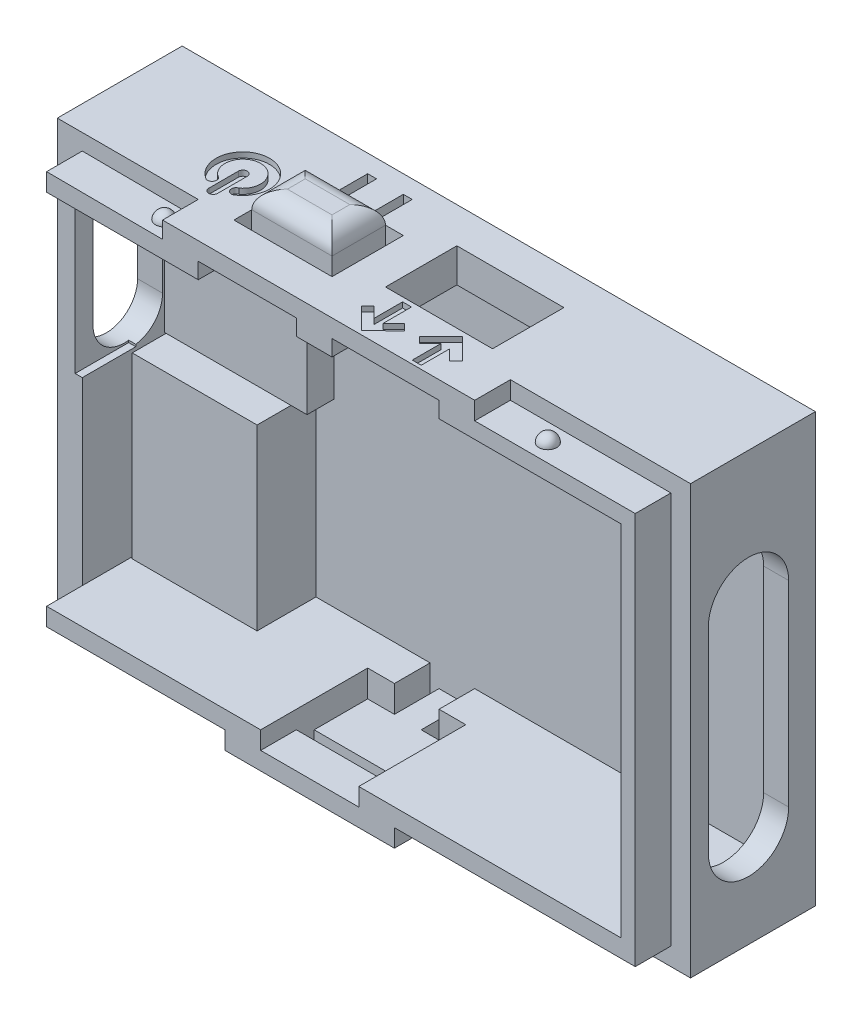
from build123d import *

# Parameters (mm, degrees)
SKETCH_1_W           = 35.5
SKETCH_1_H           = 24
EXTRUDE_1_DEPTH      = 7
SKETCH_2_W           = 33.2
SKETCH_2_H           = 22.1
CUT_EXTRUDE_1_DEPTH  = 6
CUT_EXTRUDE_2_DEPTH  = 2
EXTRUDE_2_DEPTH      = 6
SKETCH_7_W           = 5
SKETCH_7_H           = 2
EXTRUDE_3_DEPTH      = 5
CUT_EXTRUDE_4_DEPTH  = 2
SKETCH_12_W          = 5.5
SKETCH_12_H          = 2
CUT_EXTRUDE_6_DEPTH  = 6
SKETCH_19_W          = 8
SKETCH_19_H          = 10
USB_DEPTH            = 1.5
SKETCH_25_W          = 0.5
SKETCH_25_H          = 18.1
CUT_EXTRUDE_12_DEPTH = 6
SKETCH_28_W          = 5.5
SKETCH_28_H          = 1.9
CUT_EXTRUDE_13_DEPTH = 6
SKETCH_29_W          = 6
SKETCH_29_H          = 2
CUT_EXTRUDE_14_DEPTH = 5
SKETCH_34_W          = 7
SKETCH_34_H          = 10
EXTRUDE_10_DEPTH     = 3.3
SKETCH_35_W          = 0.5
SKETCH_35_H          = 10
CUT_EXTRUDE_15_DEPTH = 3
SKETCH_37_W          = 4.5
SKETCH_37_H          = 2
EXTRUDE_12_DEPTH     = 5.5
SKETCH_38_W          = 1.5
SKETCH_38_H          = 2.5
CUT_EXTRUDE_16_DEPTH = 2
SKETCH_39_W          = 4.5
SKETCH_39_H          = 1
CUT_EXTRUDE_17_DEPTH = 5.5
SKETCH_40_W          = 4.5
SKETCH_40_H          = 3
EXTRUDE_13_DEPTH     = 1.5
FILLET_2_R           = 1
SKETCH_41_W          = 4.5
SKETCH_41_H          = 2
EXTRUDE_14_DEPTH     = 5.5
SKETCH_42_W          = 1.5
SKETCH_42_H          = 2.5
CUT_EXTRUDE_18_DEPTH = 2
SKETCH_43_W          = 4.5
SKETCH_43_H          = 1
CUT_EXTRUDE_19_DEPTH = 5.5
SKETCH_44_W          = 4.5
SKETCH_44_H          = 3
EXTRUDE_15_DEPTH     = 1.5
FILLET_3_R           = 1
EXTRUDE_16_DEPTH     = 2
SKETCH_50_W          = 5.5
SKETCH_50_H          = 2
CUT_EXTRUDE_20_DEPTH = 2
SKETCH_51_W          = 5.5
SKETCH_51_H          = 2
CUT_EXTRUDE_21_DEPTH = 2
SKETCH_54_W          = 2
SKETCH_54_H          = 0.95
EXTRUDE_19_DEPTH     = 2
SKETCH_55_W          = 2
SKETCH_55_H          = 1
EXTRUDE_20_DEPTH     = 15.5
SKETCH_56_W          = 2
SKETCH_56_H          = 1
EXTRUDE_21_DEPTH     = 2
SKETCH_57_W          = 2
SKETCH_57_H          = 1
EXTRUDE_22_DEPTH     = 7.5
SKETCH_58_W          = 1.5
SKETCH_58_H          = 1.9
SKETCH_58_H_2        = 2
EXTRUDE_24_DEPTH     = 2
SKETCH_59_W          = 6
SKETCH_59_H          = 1
EXTRUDE_25_DEPTH     = 1
CUT_EXTRUDE_22_DEPTH = 0.3
CUT_EXTRUDE_23_DEPTH = 0.3


with BuildPart() as part:
    # 草图1 → 凸台-拉伸1 (new body)
    with BuildSketch(Plane.XY):
        Rectangle(SKETCH_1_W, SKETCH_1_H)
    extrude(amount=EXTRUDE_1_DEPTH)

    # 草图2 → 切除-拉伸1 (cut)
    with BuildSketch(Plane.XY.offset(7)):
        with Locations((0.25, 0.05)):
            Rectangle(SKETCH_2_W, SKETCH_2_H)
    extrude(amount=-CUT_EXTRUDE_1_DEPTH, mode=Mode.SUBTRACT)

    # 草图3 → 切除-拉伸2 (cut)
    with BuildSketch(Plane.ZY.offset(17.75)):
        with BuildLine():
            Line((6, 7.45), (6, 1.95))
            ThreePointArc((6, 1.95), (4.25, 0.2), (2.5, 1.95))
            Line((2.5, 1.95), (2.5, 7.45))
            ThreePointArc((2.5, 7.45), (4.25, 9.2), (6, 7.45))
        make_face()
    extrude(amount=-CUT_EXTRUDE_2_DEPTH, mode=Mode.SUBTRACT)

    # 草图6 → 凸台-拉伸2 (add)
    with BuildSketch(Plane.XY.offset(1)):
        Polygon((-16.35, 10.1), (15.85, 10.1), (15.85, -10), (-16.35, -10), (-16.35, -11), (16.85, -11), (16.85, 11.1), (-16.35, 11.1), align=None)
    extrude(amount=EXTRUDE_2_DEPTH)

    # 草图7 → 凸台-拉伸3 (add)
    with BuildSketch(Plane.XY.offset(1)):
        with Locations((13.35, 9.1)):
            Rectangle(SKETCH_7_W, SKETCH_7_H)
    extrude(amount=EXTRUDE_3_DEPTH)

    # 草图10 → 切除-拉伸4 (cut)
    with BuildSketch(Plane.ZY.offset(-15.85)):
        with BuildLine():
            Line((1.5, -6.45), (1.5, 4.55))
            ThreePointArc((1.5, 4.55), (3.75, 6.8), (6, 4.55))
            Line((6, 4.55), (6, -6.45))
            ThreePointArc((6, -6.45), (3.75, -8.7), (1.5, -6.45))
        make_face()
    extrude(amount=-CUT_EXTRUDE_4_DEPTH, mode=Mode.SUBTRACT)

    # 草图12 → 切除-拉伸6 (cut)
    with BuildSketch(Plane.XY.offset(7)):
        with Locations((-1.6, -11)):
            Rectangle(SKETCH_12_W, SKETCH_12_H)
    extrude(amount=-CUT_EXTRUDE_6_DEPTH, mode=Mode.SUBTRACT)

    # 草图19 → USB支撑 (add)
    with BuildSketch(Plane.XY.offset(1)):
        with Locations((-12.25, 5.1)):
            Rectangle(SKETCH_19_W, SKETCH_19_H)
    extrude(amount=USB_DEPTH)

    # 草图25 → 切除-拉伸12 (cut)
    with BuildSketch(Plane.XY.offset(7)):
        with Locations((16.1, -0.95)):
            Rectangle(SKETCH_25_W, SKETCH_25_H)
    extrude(amount=-CUT_EXTRUDE_12_DEPTH, mode=Mode.SUBTRACT)

    # 草图28 → 切除-拉伸13 (cut)
    with BuildSketch(Plane.XY.offset(7)):
        with Locations((-5.1, 11.05)):
            Rectangle(SKETCH_28_W, SKETCH_28_H)
    extrude(amount=-CUT_EXTRUDE_13_DEPTH, mode=Mode.SUBTRACT)

    # 草图29 → 切除-拉伸14 (cut)
    with BuildSketch(Plane.XY.offset(7)):
        with Locations((2.65, 11)):
            Rectangle(SKETCH_29_W, SKETCH_29_H)
    extrude(amount=-CUT_EXTRUDE_14_DEPTH, mode=Mode.SUBTRACT)

    # 草图34 → 凸台-拉伸10 (add)
    with BuildSketch(Plane.XY.offset(1)):
        with Locations((-12.75, -5)):
            Rectangle(SKETCH_34_W, SKETCH_34_H)
    extrude(amount=EXTRUDE_10_DEPTH)

    # 草图35 → 切除-拉伸15 (cut)
    with BuildSketch(Plane.XY.offset(7)):
        with Locations((-16.5, 5.1)):
            Rectangle(SKETCH_35_W, SKETCH_35_H)
    extrude(amount=-CUT_EXTRUDE_15_DEPTH, mode=Mode.SUBTRACT)

    # 草图37 → 凸台-拉伸12 (add)
    with BuildSketch(Plane.XY.offset(1)):
        with Locations((-1.6, -11)):
            Rectangle(SKETCH_37_W, SKETCH_37_H)
    extrude(amount=EXTRUDE_12_DEPTH)

    # 草图38 → 切除-拉伸16 (cut)
    with BuildSketch(Plane.XZ.offset(12)):
        with Locations((-3.1, 2.25)):
            Rectangle(SKETCH_38_W, SKETCH_38_H)
        with Locations((-0.1, 2.25)):
            Rectangle(SKETCH_38_W, SKETCH_38_H)
    extrude(amount=-CUT_EXTRUDE_16_DEPTH, mode=Mode.SUBTRACT)

    # 草图39 → 切除-拉伸17 (cut)
    with BuildSketch(Plane.XY.offset(6.5)):
        with Locations((-1.6, -10.5)):
            Rectangle(SKETCH_39_W, SKETCH_39_H)
    extrude(amount=-CUT_EXTRUDE_17_DEPTH, mode=Mode.SUBTRACT)

    # 草图40 → 凸台-拉伸13 (add)
    with BuildSketch(Plane.XZ.offset(12)):
        with Locations((-1.6, 5)):
            Rectangle(SKETCH_40_W, SKETCH_40_H)
    extrude(amount=EXTRUDE_13_DEPTH)

    # 圆角2
    fillet_2_edges = [part.edges().sort_by_distance(p)[0] for p in [
        (-1.6, -13.5, 3.5),
        (0.65, -13.5, 5),
        (-1.6, -13.5, 6.5),
        (-3.85, -13.5, 5),
    ]]
    fillet(fillet_2_edges, radius=FILLET_2_R)

    # 草图41 → 凸台-拉伸14 (add)
    with BuildSketch(Plane.XY.offset(1)):
        with Locations((-5.1, 11)):
            Rectangle(SKETCH_41_W, SKETCH_41_H)
    extrude(amount=EXTRUDE_14_DEPTH)

    # 草图42 → 切除-拉伸18 (cut)
    with BuildSketch(Plane(origin=(0, 12, 0), x_dir=(1, 0, 0), z_dir=(0, 1, 0))):
        with Locations((-6.6, -2.25)):
            Rectangle(SKETCH_42_W, SKETCH_42_H)
        with Locations((-3.6, -2.25)):
            Rectangle(SKETCH_42_W, SKETCH_42_H)
    extrude(amount=-CUT_EXTRUDE_18_DEPTH, mode=Mode.SUBTRACT)

    # 草图43 → 切除-拉伸19 (cut)
    with BuildSketch(Plane.XY.offset(6.5)):
        with Locations((-5.1, 10.5)):
            Rectangle(SKETCH_43_W, SKETCH_43_H)
    extrude(amount=-CUT_EXTRUDE_19_DEPTH, mode=Mode.SUBTRACT)

    # 草图44 → 凸台-拉伸15 (add)
    with BuildSketch(Plane(origin=(0, 12, 0), x_dir=(1, 0, 0), z_dir=(0, 1, 0))):
        with Locations((-5.1, -5)):
            Rectangle(SKETCH_44_W, SKETCH_44_H)
    extrude(amount=EXTRUDE_15_DEPTH)

    # 圆角3
    fillet_3_edges = [part.edges().sort_by_distance(p)[0] for p in [
        (-2.85, 13.5, 5),
        (-5.1, 13.5, 3.5),
        (-7.35, 13.5, 5),
        (-5.1, 13.5, 6.5),
    ]]
    fillet(fillet_3_edges, radius=FILLET_3_R)

    # 草图45 → 凸台-拉伸16 (add)
    with BuildSketch(Plane.XY.offset(7)):
        Polygon((-7.85, 10.1), (-16.35, 10.1), (-16.35, 11.1), (-7.85, 11.05), (-2.25, 11.05), (-0.35, 11.05), (-0.35, 10.1), (-2.35, 10.1), align=None)
        Polygon((1.25, -11), (-16.35, -11), (-16.35, -10), (1.15, -10), (15.85, -10), (15.85, 10.1), (5.65, 10.1), (5.65, 11), (16.65, 11), (16.65, 10), (16.65, -11), align=None)
    extrude(amount=EXTRUDE_16_DEPTH)

    # 草图46 → 旋转1 (revolve)
    with BuildSketch(Plane.XZ.offset(11)):
        with BuildLine():
            Line((-11.25, 8), (-10.25, 8))
            ThreePointArc((-10.25, 8), (-10.75, 8.5), (-11.25, 8))
        make_face()
    revolve(axis=Axis((-11.25, -11, 8), (1, 0, 0)))

    # 草图47 → 旋转2 (revolve)
    with BuildSketch(Plane.XZ.offset(11)):
        with BuildLine():
            Line((11.25, 8), (10.25, 8))
            ThreePointArc((10.25, 8), (10.75, 8.5), (11.25, 8))
        make_face()
    revolve(axis=Axis((11.25, -11, 8), (-1, 0, 0)))

    # 草图48 → 旋转3 (revolve)
    with BuildSketch(Plane(origin=(0, 11.05, 0), x_dir=(1, 0, 0), z_dir=(0, 1, 0))):
        with BuildLine():
            Line((-11.25, -8), (-10.25, -8))
            ThreePointArc((-10.25, -8), (-10.75, -7.5), (-11.25, -8))
        make_face()
    revolve(axis=Axis((-11.25, 11.05, 8), (1, 0, 0)))

    # 草图49 → 旋转4 (revolve)
    with BuildSketch(Plane(origin=(0, 11, 0), x_dir=(1, 0, 0), z_dir=(0, 1, 0))):
        with BuildLine():
            Line((10.25, -8), (11.25, -8))
            ThreePointArc((11.25, -8), (10.75, -7.5), (10.25, -8))
        make_face()
    revolve(axis=Axis((10.25, 11, 8), (1, 0, 0)))

    # 草图50 → 切除-拉伸20 (cut)
    with BuildSketch(Plane.XZ.offset(-10.1)):
        with Locations((-5.1, 8)):
            Rectangle(SKETCH_50_W, SKETCH_50_H)
    extrude(amount=-CUT_EXTRUDE_20_DEPTH, mode=Mode.SUBTRACT)

    # 草图51 → 切除-拉伸21 (cut)
    with BuildSketch(Plane.XZ.offset(11)):
        with Locations((-1.6, 8)):
            Rectangle(SKETCH_51_W, SKETCH_51_H)
    extrude(amount=-CUT_EXTRUDE_21_DEPTH, mode=Mode.SUBTRACT)

    # 草图54 → 凸台-拉伸19 (add)
    with BuildSketch(Plane.XY.offset(7)):
        with Locations((-8.85, 11.525)):
            Rectangle(SKETCH_54_W, SKETCH_54_H)
    extrude(amount=EXTRUDE_19_DEPTH)

    # 草图55 → 凸台-拉伸20 (add)
    with BuildSketch(Plane(origin=(-7.85, 0, 0), x_dir=(0, 0, -1), z_dir=(1, 0, 0))):
        with Locations((-8, 11.5)):
            Rectangle(SKETCH_55_W, SKETCH_55_H)
    extrude(amount=EXTRUDE_20_DEPTH)

    # 草图56 → 凸台-拉伸21 (add)
    with BuildSketch(Plane.XY.offset(7)):
        with Locations((-5.35, -11.5)):
            Rectangle(SKETCH_56_W, SKETCH_56_H)
    extrude(amount=EXTRUDE_21_DEPTH)

    # 草图57 → 凸台-拉伸22 (add)
    with BuildSketch(Plane(origin=(-4.35, 0, 0), x_dir=(0, 0, -1), z_dir=(1, 0, 0))):
        with Locations((-8, -11.5)):
            Rectangle(SKETCH_57_W, SKETCH_57_H)
    extrude(amount=EXTRUDE_22_DEPTH)

    # 草图58 → 凸台-拉伸24 (add)
    with BuildSketch(Plane.XY.offset(1)):
        with Locations((-7.1, 11.05)):
            Rectangle(SKETCH_58_W, SKETCH_58_H)
        with Locations((-3.1, 11.05)):
            Rectangle(SKETCH_58_W, SKETCH_58_H)
        with Locations((-3.6, -11)):
            Rectangle(SKETCH_58_W, SKETCH_58_H_2)
        with Locations((0.4, -11)):
            Rectangle(SKETCH_58_W, SKETCH_58_H_2)
    extrude(amount=EXTRUDE_24_DEPTH)

    # 草图59 → 凸台-拉伸25 (add)
    with BuildSketch(Plane(origin=(0, 0, 7), x_dir=(-1, 0, 0), z_dir=(0, 0, -1))):
        with Locations((-2.65, 11.5)):
            Rectangle(SKETCH_59_W, SKETCH_59_H)
    extrude(amount=EXTRUDE_25_DEPTH)

    # 草图61 → 切除-拉伸22 (cut)
    with BuildSketch(Plane(origin=(0, 12, 0), x_dir=(1, 0, 0), z_dir=(0, 1, 0))):
        with BuildLine():
            Line((-9.6, -6.159611152), (-9.6, -4.5))
            ThreePointArc((-9.6, -4.5), (-9.85, -4.25), (-10.1, -4.5))
            Line((-10.1, -4.5), (-10.1, -6.159611152))
            ThreePointArc((-10.1, -6.159611152), (-9.85, -6.409611152), (-9.6, -6.159611152))
        make_face()
        with BuildLine():
            ThreePointArc((-9.101668523, -5.8), (-9.85, -3), (-10.598331477, -5.8))
            ThreePointArc((-10.598331477, -5.8), (-10.274165739, -5.624165739), (-10.45, -5.3))
            ThreePointArc((-10.45, -5.3), (-9.85, -3.5), (-9.25, -5.3))
            ThreePointArc((-9.25, -5.3), (-9.425834261, -5.624165739), (-9.101668523, -5.8))
        make_face()
    extrude(amount=-CUT_EXTRUDE_22_DEPTH, mode=Mode.SUBTRACT)

    # 草图60 → 切除-拉伸23 (cut)
    with BuildSketch(Plane(origin=(0, 12, 0), x_dir=(1, 0, 0), z_dir=(0, 1, 0))):
        Polygon((4.45, -8.8), (4.45, -7.2), (5.049338639, -7.8), (5.403086939, -7.446641626), (4.200665644, -6.242893478), (2.995979535, -7.4462517), (3.349337909, -7.8), (3.95, -7.2), (3.95, -8.8), align=None)
        Polygon((1.35, -6.242893478), (0.85, -6.242893478), (0.85, -7.842893478), (0.250661361, -7.242893478), (-0.103086939, -7.596251853), (1.099334356, -8.8), (2.304020465, -7.596641778), (1.950662091, -7.242893478), (1.35, -7.842893478), align=None)
    extrude(amount=-CUT_EXTRUDE_23_DEPTH, mode=Mode.SUBTRACT)


solid = part.part
